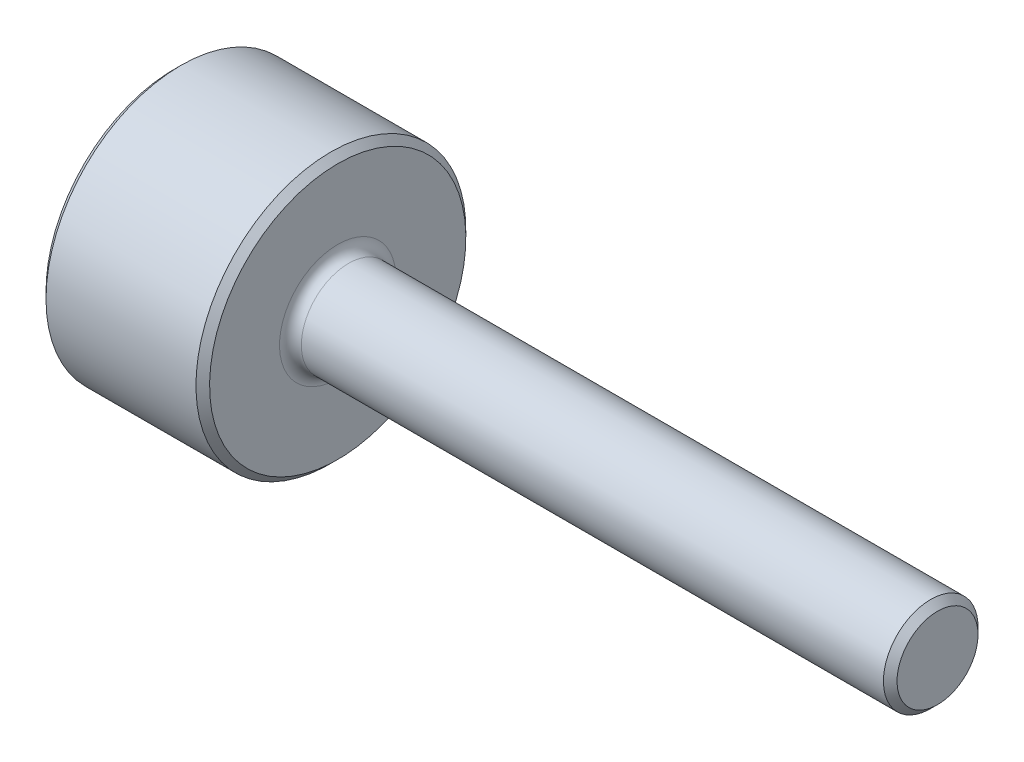
from build123d import *

# Parameters (mm, degrees)
CHAMFER1_SIZE = 0.25
FILLET1_R     = 0.4


with BuildPart() as part:
    # Sketch1 → Revolve1 (revolve)
    with BuildSketch(Plane.XY):
        Polygon((0, 0), (0, 1.735), (-22, 1.735), (-22, 4.95), (-28, 4.95), (-28, 0), align=None)
    revolve(axis=Axis((0, 0, 0), (-1, 0, 0)))

    # Chamfer1
    chamfer1_edges = [part.edges().sort_by_distance(p)[0] for p in [
        (0, -1.735, 0),
        (-22, -4.95, 0),
        (-28, -4.95, 0),
    ]]
    chamfer(chamfer1_edges, length=CHAMFER1_SIZE)

    # Fillet1
    fillet1_edges = [part.edges().sort_by_distance(p)[0] for p in [
        (-22, -1.735, 0),
    ]]
    fillet(fillet1_edges, radius=FILLET1_R)


solid = part.part
